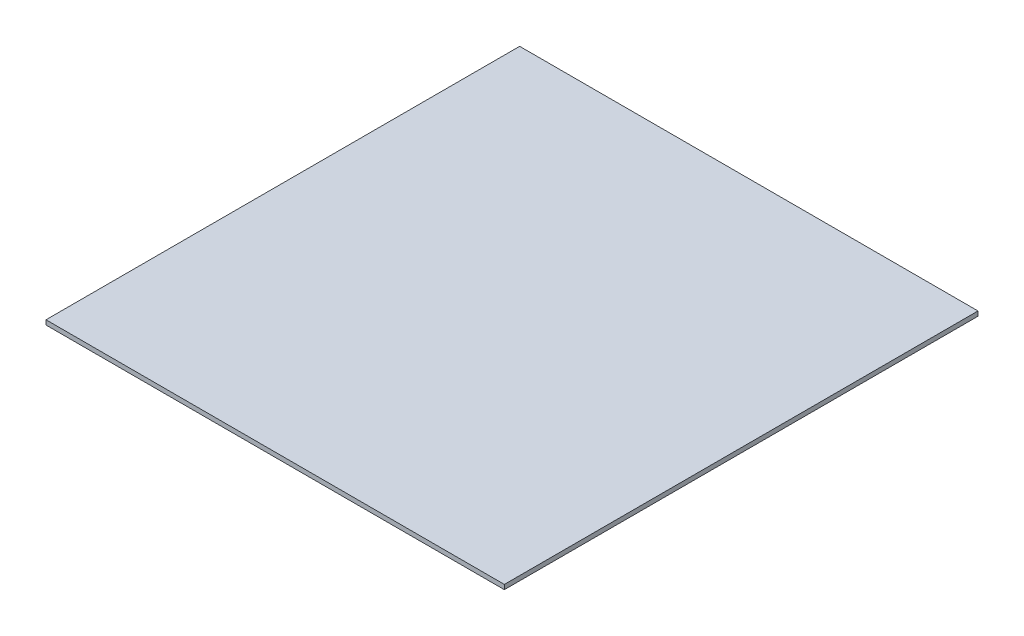
from build123d import *

# Parameters (mm, degrees)
SKETCH1_W           = 300
SKETCH1_H           = 310
BOSS_EXTRUDE1_DEPTH = 3


with BuildPart() as part:
    # Sketch1 → Boss-Extrude1 (new body)
    with BuildSketch(Plane(origin=(0, 0, 0), x_dir=(1, 0, 0), z_dir=(0, 1, 0))):
        Rectangle(SKETCH1_W, SKETCH1_H)
    extrude(amount=BOSS_EXTRUDE1_DEPTH)


solid = part.part
